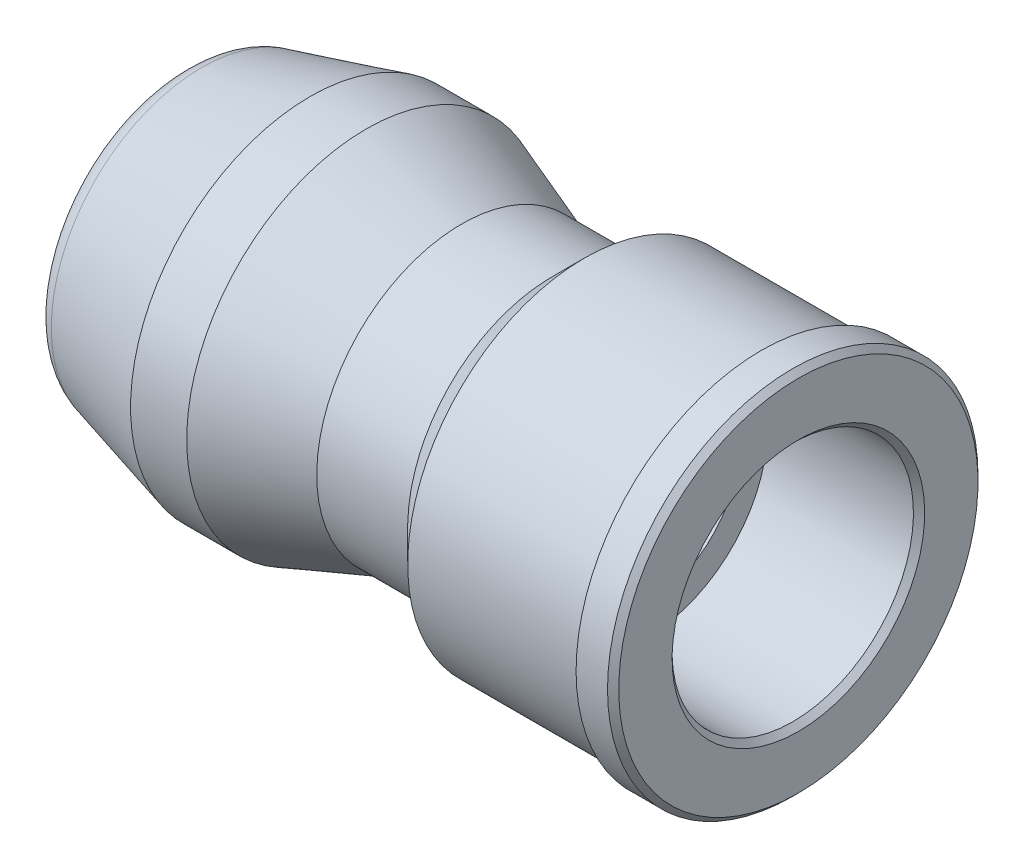
from build123d import *

# Parameters (mm, degrees)
M4_DI_LI_DELIK2_D           = 3.3
M4_DI_LI_DELIK2_CSINK_D     = 4.05
M4_DI_LI_DELIK2_CSINK_ANGLE = 45
RADYUS1_SIZE                = 0.1
RADYUS2_R                   = 0.5


with BuildPart() as part:
    # Çizim1 → Döndür1 (revolve)
    with BuildSketch(Plane.XY, mode=Mode.PRIVATE) as d_nd_r1_sk:
        Polygon((0, 0), (0, 2.58), (2.3, 3.196283143), (3.3, 3.196283143), (5, 2.58), (6.62, 2.58), (7.19, 3.15), (10.34, 3.15), (10.34, 3.3), (11, 3.3), (11, 2.15), (8.3, 2.15), (8.3, 0), align=None)
    revolve(d_nd_r1_sk.sketch.rotate(Axis((0, 0, 0), (1, 0, 0)), 180), axis=Axis((0, 0, 0), (1, 0, 0)))

    # M4 Dişli Delik2 (through all)
    with Locations(Plane.ZY):
        with Locations((0, 0)):
            CounterSinkHole(M4_DI_LI_DELIK2_D / 2, M4_DI_LI_DELIK2_CSINK_D / 2, counter_sink_angle=M4_DI_LI_DELIK2_CSINK_ANGLE)

    # Radyus1
    radyus1_edges = [part.edges().sort_by_distance(p)[0] for p in [
        (11, 3.3, 0),
        (10.34, 3.15, 0),
        (11, 2.15, 0),
    ]]
    chamfer(radyus1_edges, length=RADYUS1_SIZE)

    # Radyus2
    radyus2_edges = [part.edges().sort_by_distance(p)[0] for p in [
        (0, 2.58, 0),
    ]]
    fillet(radyus2_edges, radius=RADYUS2_R)


solid = part.part
